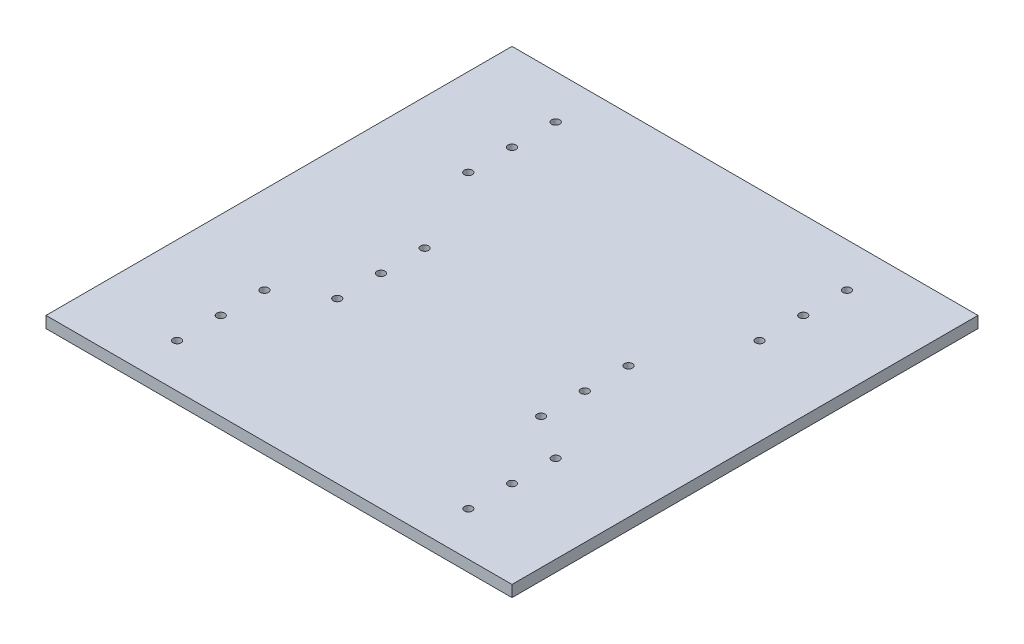
from build123d import *

# Parameters (mm, degrees)
SKETCH2_W                 = 203.2
SKETCH2_H                 = 203.2
BASE_DEPTH                = 4.99999
TAP_DRILL_FOR_8_32_TAP1_D = 3.4544


with BuildPart() as part:
    # Sketch2 → Base (new body)
    with BuildSketch(Plane(origin=(0, 0, 0), x_dir=(1, 0, 0), z_dir=(0, 1, 0))):
        Rectangle(SKETCH2_W, SKETCH2_H)
    extrude(amount=BASE_DEPTH)

    # Tap Drill for #8-32 Tap1 (through all)
    with Locations(Plane(origin=(0, 4.99999, 0), x_dir=(1, 0, 0), z_dir=(0, 1, 0))):
        with Locations((-44.45, 6.35), (-44.45, -12.7), (-44.45, -31.75), (44.45, -31.75), (44.45, -12.7), (44.45, 6.35), (-63.5, -44.45), (-63.5, -63.5), (-63.5, -82.55), (63.5, -44.45), (63.5, -82.55), (63.5, -63.5), (63.5, 82.55), (63.5, 63.5), (63.5, 44.45), (-63.5, 44.45), (-63.5, 63.5), (-63.5, 82.55)):
            Hole(TAP_DRILL_FOR_8_32_TAP1_D / 2)


solid = part.part
